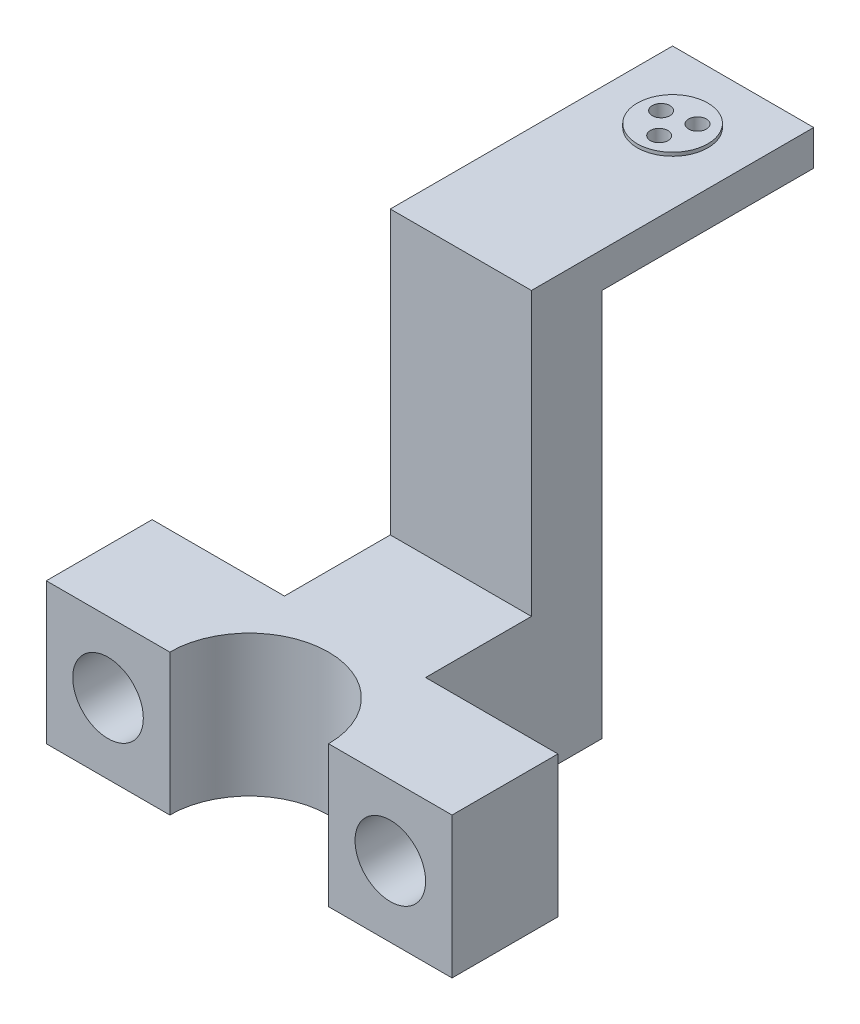
from build123d import *

# Parameters (mm, degrees)
SKETCH2_W           = 115
SKETCH2_H           = 40
BOSS_EXTRUDE1_DEPTH = 60
CUT_EXTRUDE1_DEPTH  = 60
SKETCH4_R           = 10
CUT_EXTRUDE2_DEPTH  = 60
SKETCH5_W           = 40
SKETCH5_H           = 40
BOSS_EXTRUDE2_DEPTH = 50
SKETCH6_W           = 40
SKETCH6_H           = 20
BOSS_EXTRUDE3_DEPTH = 70
SKETCH7_W           = 40
SKETCH7_H           = 80
BOSS_EXTRUDE4_DEPTH = 10
SKETCH9_R           = 10
BOSS_EXTRUDE5_DEPTH = 1
SKETCH10_R          = 2.5
CUT_EXTRUDE3_DEPTH  = 15


with BuildPart() as part:
    # Sketch2 → Boss-Extrude1 (new body)
    with BuildSketch(Plane.XY):
        with Locations((-2.12962963, 23.505291005)):
            Rectangle(SKETCH2_W, SKETCH2_H)
    extrude(amount=BOSS_EXTRUDE1_DEPTH)

    # Sketch3 → Cut-Extrude1 (cut)
    with BuildSketch(Plane(origin=(0, 43.505291005, 0), x_dir=(1, 0, 0), z_dir=(0, 1, 0))):
        with BuildLine():
            Line((-59.62962963, -30), (-24.62962963, -30))
            ThreePointArc((-24.62962963, -30), (-2.12962963, -7.5), (20.37037037, -30))
            Line((20.37037037, -30), (55.37037037, -30))
            Line((55.37037037, -30), (55.37037037, -60))
            Line((55.37037037, -60), (-59.62962963, -60))
            Line((-59.62962963, -60), (-59.62962963, -30))
        make_face()
    extrude(amount=-CUT_EXTRUDE1_DEPTH, mode=Mode.SUBTRACT)

    # Sketch4 → Cut-Extrude2 (cut)
    with BuildSketch(Plane.XY.offset(30)):
        with Locations((-42.12962963, 23.505291005)):
            Circle(SKETCH4_R)
        with Locations((37.87037037, 23.505291005)):
            Circle(SKETCH4_R)
    extrude(amount=-CUT_EXTRUDE2_DEPTH, mode=Mode.SUBTRACT)

    # Sketch5 → Boss-Extrude2 (add)
    with BuildSketch(Plane(origin=(0, 0, 0), x_dir=(-1, 0, 0), z_dir=(0, 0, -1))):
        with Locations((2.12962963, 23.505291005)):
            Rectangle(SKETCH5_W, SKETCH5_H)
    extrude(amount=BOSS_EXTRUDE2_DEPTH)

    # Sketch6 → Boss-Extrude3 (add)
    with BuildSketch(Plane(origin=(0, 43.505291005, 0), x_dir=(1, 0, 0), z_dir=(0, 1, 0))):
        with Locations((-2.12962963, 40)):
            Rectangle(SKETCH6_W, SKETCH6_H)
    extrude(amount=BOSS_EXTRUDE3_DEPTH)

    # Sketch7 → Boss-Extrude4 (add)
    with BuildSketch(Plane(origin=(0, 113.505291005, 0), x_dir=(1, 0, 0), z_dir=(0, 1, 0))):
        with Locations((-2.12962963, 70)):
            Rectangle(SKETCH7_W, SKETCH7_H)
    extrude(amount=BOSS_EXTRUDE4_DEPTH)

    # Sketch9 → Boss-Extrude5 (add)
    with BuildSketch(Plane(origin=(0, 123.505291005, 0), x_dir=(1, 0, 0), z_dir=(0, 1, 0))):
        with Locations(Location((-2.12962963, 90, 0), (0, 0, 90))):
            Circle(SKETCH9_R)
    extrude(amount=BOSS_EXTRUDE5_DEPTH)

    # Sketch10 → Cut-Extrude3 (cut)
    with BuildSketch(Plane(origin=(0, 124.505291005, 0), x_dir=(1, 0, 0), z_dir=(0, 1, 0))):
        with Locations(Location((-6.896940429, 91.507563511, 0), (0, 0, 270))):
            Circle(SKETCH10_R)
        with Locations(Location((1.559614069, 93.374830505, 0), (0, 0, 270))):
            Circle(SKETCH10_R)
        with Locations(Location((-1.051562528, 85.117605984, 0), (0, 0, 270))):
            Circle(SKETCH10_R)
    extrude(amount=-CUT_EXTRUDE3_DEPTH, mode=Mode.SUBTRACT)


solid = part.part
